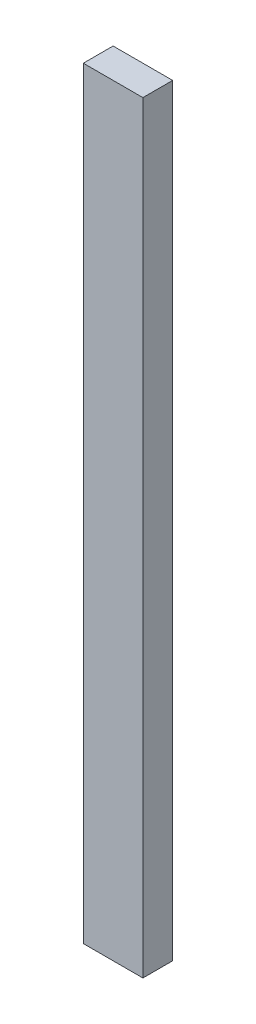
from build123d import *

# Parameters (mm, degrees)
SKETCH1_W           = 40
SKETCH1_H           = 512
BOSS_EXTRUDE1_DEPTH = 20


with BuildPart() as part:
    # Sketch1 → Boss-Extrude1 (new body)
    with BuildSketch(Plane.XY):
        with Locations((35, -260)):
            Rectangle(SKETCH1_W, SKETCH1_H)
    extrude(amount=BOSS_EXTRUDE1_DEPTH)


solid = part.part
